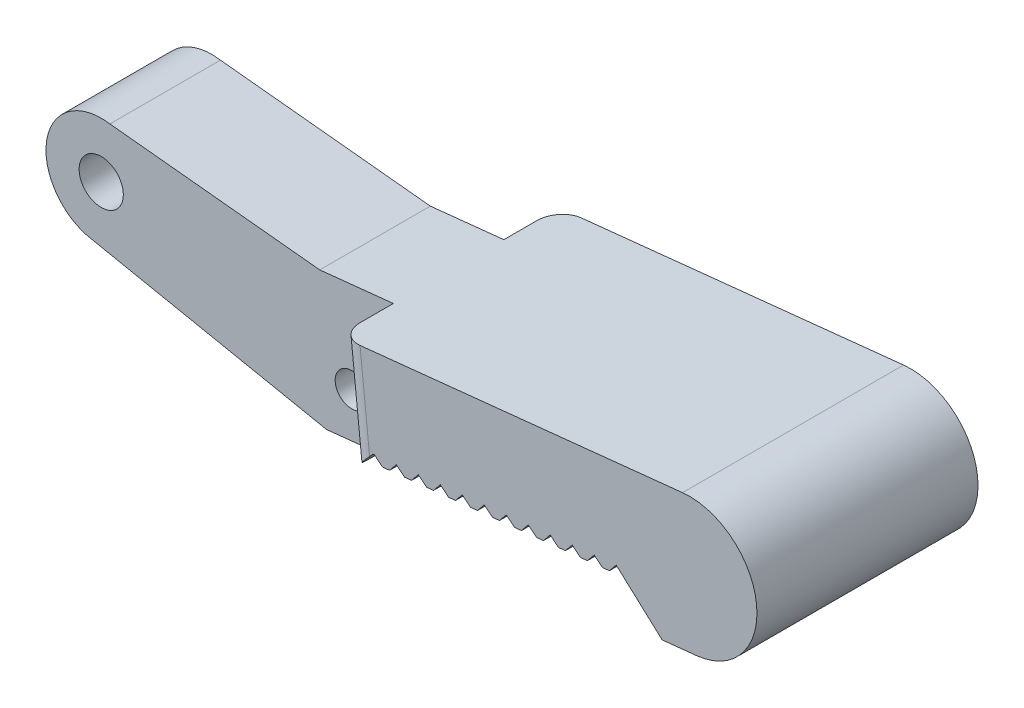
from build123d import *
from OCP.BRepFilletAPI import BRepFilletAPI_MakeChamfer

# Parameters (mm, degrees)
BOSS_EXTRUDE1_DEPTH          = 10
BOSS_EXTRUDE2_START          = 5
BOSS_EXTRUDE2_DEPTH          = 5
BOSS_EXTRUDE3_DEPTH          = 5
CUT_EXTRUDE1_DEPTH           = 101.346230266
CUT_EXTRUDE2_DEPTH           = 101.346230266
CUT_EXTRUDE3_DEPTH           = 101.346230266
CUT_EXTRUDE4_DEPTH           = 101.346230266
CUT_EXTRUDE5_DEPTH           = 101.346230266
CUT_EXTRUDE6_DEPTH           = 101.346230266
CUT_EXTRUDE7_DEPTH           = 101.346230266
CUT_EXTRUDE8_DEPTH           = 101.346230266
CUT_EXTRUDE9_DEPTH           = 101.346230266
CUT_EXTRUDE10_DEPTH          = 101.346230266
F_3_0_3_DIAMETER_HOLE1_D     = 3
F_3_0_3_DIAMETER_HOLE1_DEPTH = 15
F_4_0_4_DIAMETER_HOLE1_D     = 4
F_4_0_4_DIAMETER_HOLE1_DEPTH = 15
CHAMFER1_SIZE                = 0.447730968
CHAMFER1_SIZE2               = 0.448197344
CHAMFER2_SIZE                = 0.447731694
CHAMFER3_SIZE                = 1.737611999
CHAMFER3_SIZE2               = 3.873994542
CHAMFER4_SIZE                = 0.077086633
CHAMFER4_SIZE2               = 0.072550959
FILLET1_R                    = 2


with BuildPart() as part:
    # Sketch1 → Boss-Extrude1 (new body)
    with BuildSketch(Plane.XY.offset(73)):
        with BuildLine():
            Line((47.149864614, 28.313385702), (52.6195399, 34.322554537))
            Line((52.6195399, 34.322554537), (64.759552346, 24.481253068))
            Line((64.759552346, 24.481253068), (74.555166546, 36.564906707))
            Line((74.555166546, 36.564906707), (78.7164935, 32.777177019))
            Line((78.7164935, 32.777177019), (81.827328883, 33.102494763))
            ThreePointArc((81.827328883, 33.102494763), (87.259793057, 39.803862757), (80.558425063, 45.236326931))
            Line((80.558425063, 45.236326931), (42.738053563, 41.281235646))
            Line((42.738053563, 41.281235646), (23.75043876, 43.222902971))
            ThreePointArc((23.75043876, 43.222902971), (18.027652603, 39.069624916), (22.180930658, 33.346838759))
            Line((22.180930658, 33.346838759), (47.149864614, 28.313385702))
        make_face()
    extrude(amount=-BOSS_EXTRUDE1_DEPTH)

    # Sketch2 → Boss-Extrude2 (add)
    with BuildSketch(Plane.XY.offset(73).offset(BOSS_EXTRUDE2_START)):
        with BuildLine():
            Line((64.759552346, 24.481253068), (52.6195399, 34.322554537))
            Line((52.6195399, 34.322554537), (50.443577375, 31.931969081))
            Line((50.443577375, 31.931969081), (49.393091426, 41.977190794))
            Line((49.393091426, 41.977190794), (80.558425063, 45.236326931))
            ThreePointArc((80.558425063, 45.236326931), (87.259793057, 39.803862757), (81.827328883, 33.102494763))
            Line((81.827328883, 33.102494763), (78.7164935, 32.777177019))
            Line((78.7164935, 32.777177019), (74.555166546, 36.564906707))
            Line((74.555166546, 36.564906707), (64.759552346, 24.481253068))
        make_face()
    extrude(amount=-BOSS_EXTRUDE2_DEPTH)

    # Sketch3 → Boss-Extrude3 (add)
    with BuildSketch(Plane(origin=(0, 0, 63), x_dir=(-1, 0, 0), z_dir=(0, 0, -1))):
        with BuildLine():
            Line((-64.759552346, 24.481253068), (-74.555166546, 36.564906707))
            Line((-74.555166546, 36.564906707), (-78.7164935, 32.777177019))
            Line((-78.7164935, 32.777177019), (-81.827328883, 33.102494763))
            ThreePointArc((-81.827328883, 33.102494763), (-87.259793057, 39.803862757), (-80.558425063, 45.236326931))
            Line((-80.558425063, 45.236326931), (-49.393091426, 41.977190794))
            Line((-49.393091426, 41.977190794), (-50.443577375, 31.931969081))
            Line((-50.443577375, 31.931969081), (-52.6195399, 34.322554537))
            Line((-52.6195399, 34.322554537), (-64.759552346, 24.481253068))
        make_face()
    extrude(amount=BOSS_EXTRUDE3_DEPTH)

    # Sketch4 → Cut-Extrude1 (cut, through all)
    with BuildSketch(Plane(origin=(0, 0, 58), x_dir=(-1, 0, 0), z_dir=(0, 0, -1))):
        Polygon((-64.759552346, 24.481253068), (-53.773703175, 33.386932043), (-54.663638401, 34.48473651), (-65.658749654, 25.590483036), align=None)
    extrude(amount=-CUT_EXTRUDE1_DEPTH, mode=Mode.SUBTRACT)

    # Sketch5 → Cut-Extrude2 (cut, through all)
    with BuildSketch(Plane(origin=(0, 0, 58), x_dir=(-1, 0, 0), z_dir=(0, 0, -1))):
        Polygon((-55.763149526, 33.595311163), (-56.652791215, 34.69275353), (-66.548391343, 26.687925403), (-65.658749654, 25.590483036), align=None)
    extrude(amount=-CUT_EXTRUDE2_DEPTH, mode=Mode.SUBTRACT)

    # Sketch6 → Cut-Extrude3 (cut, through all)
    with BuildSketch(Plane(origin=(0, 0, 58), x_dir=(-1, 0, 0), z_dir=(0, 0, -1))):
        Polygon((-57.752302341, 33.803328183), (-58.64194403, 34.90077055), (-67.438033032, 27.78536777), (-66.548391343, 26.687925403), align=None)
    extrude(amount=-CUT_EXTRUDE3_DEPTH, mode=Mode.SUBTRACT)

    # Sketch7 → Cut-Extrude4 (cut, through all)
    with BuildSketch(Plane(origin=(0, 0, 58), x_dir=(-1, 0, 0), z_dir=(0, 0, -1))):
        Polygon((-59.741455155, 34.011345202), (-60.631096844, 35.108787569), (-68.327674721, 28.882810137), (-67.438033032, 27.78536777), align=None)
    extrude(amount=-CUT_EXTRUDE4_DEPTH, mode=Mode.SUBTRACT)

    # Sketch8 → Cut-Extrude5 (cut, through all)
    with BuildSketch(Plane(origin=(0, 0, 58), x_dir=(-1, 0, 0), z_dir=(0, 0, -1))):
        Polygon((-61.73060797, 34.219362222), (-62.620249659, 35.316804589), (-69.217316411, 29.980252504), (-68.327674721, 28.882810137), align=None)
    extrude(amount=-CUT_EXTRUDE5_DEPTH, mode=Mode.SUBTRACT)

    # Sketch9 → Cut-Extrude6 (cut, through all)
    with BuildSketch(Plane(origin=(0, 0, 58), x_dir=(-1, 0, 0), z_dir=(0, 0, -1))):
        Polygon((-63.719760784, 34.427379242), (-64.609402474, 35.524821609), (-70.1069581, 31.077694871), (-69.217316411, 29.980252504), align=None)
    extrude(amount=-CUT_EXTRUDE6_DEPTH, mode=Mode.SUBTRACT)

    # Sketch10 → Cut-Extrude7 (cut, through all)
    with BuildSketch(Plane(origin=(0, 0, 58), x_dir=(-1, 0, 0), z_dir=(0, 0, -1))):
        Polygon((-65.708913599, 34.635396261), (-66.598555288, 35.732838628), (-70.996599789, 32.175137239), (-70.1069581, 31.077694871), align=None)
    extrude(amount=-CUT_EXTRUDE7_DEPTH, mode=Mode.SUBTRACT)

    # Sketch11 → Cut-Extrude8 (cut, through all)
    with BuildSketch(Plane(origin=(0, 0, 58), x_dir=(-1, 0, 0), z_dir=(0, 0, -1))):
        Polygon((-70.996599789, 32.175137239), (-67.697704384, 34.843706137), (-68.589121223, 35.941003426), (-71.884095525, 33.269932405), align=None)
    extrude(amount=-CUT_EXTRUDE8_DEPTH, mode=Mode.SUBTRACT)

    # Sketch12 → Cut-Extrude9 (cut, through all)
    with BuildSketch(Plane(origin=(0, 0, 58), x_dir=(-1, 0, 0), z_dir=(0, 0, -1))):
        Polygon((-69.686925691, 35.0510682), (-70.576860917, 36.148872668), (-72.775883168, 34.370021973), (-71.884095525, 33.269932405), align=None)
    extrude(amount=-CUT_EXTRUDE9_DEPTH, mode=Mode.SUBTRACT)

    # Sketch13 → Cut-Extrude10 (cut, through all)
    with BuildSketch(Plane(origin=(0, 0, 58), x_dir=(-1, 0, 0), z_dir=(0, 0, -1))):
        Polygon((-71.676372042, 35.25944732), (-72.566013732, 36.356889687), (-73.665524857, 35.46746434), (-72.775883168, 34.370021973), align=None)
    extrude(amount=-CUT_EXTRUDE10_DEPTH, mode=Mode.SUBTRACT)

    # Ø3.0 (3) Diameter Hole1
    with Locations(Plane.XY.offset(73)):
        with Locations((45.629259616, 33.33886952)):
            Hole(F_3_0_3_DIAMETER_HOLE1_D / 2, depth=F_3_0_3_DIAMETER_HOLE1_DEPTH)

    # Ø4.0 (4) Diameter Hole1
    with Locations(Plane.XY.offset(73)):
        with Locations((22.965684709, 38.284870865)):
            Hole(F_4_0_4_DIAMETER_HOLE1_D / 2, depth=F_4_0_4_DIAMETER_HOLE1_DEPTH)

    # Chamfer1: one chamfer whose edges measure the first distance from different faces: ONE call of the kernel's chamfer builder (chamfer() names one face for all edges)
    chamfer1_edges_1 = [part.edges().sort_by_distance(p)[0] for p in [
        (57.752302341, 33.803328183, 68),
    ]]
    chamfer1_side_1 = [part.faces().sort_by_distance(p)[0] for p in [
        (58.197123185, 34.352049366, 68),
    ]]
    chamfer1_edges_2 = [part.edges().sort_by_distance(p)[0] for p in [
        (59.741455155, 34.011345202, 68),
    ]]
    chamfer1_side_2 = [part.faces().sort_by_distance(p)[0] for p in [
        (60.186276, 34.560066386, 68),
    ]]
    chamfer1_edges_3 = [part.edges().sort_by_distance(p)[0] for p in [
        (61.73060797, 34.219362222, 68),
    ]]
    chamfer1_side_3 = [part.faces().sort_by_distance(p)[0] for p in [
        (62.175428814, 34.768083405, 68),
    ]]
    chamfer1_edges_4 = [part.edges().sort_by_distance(p)[0] for p in [
        (63.719760784, 34.427379242, 68),
    ]]
    chamfer1_side_4 = [part.faces().sort_by_distance(p)[0] for p in [
        (64.164581629, 34.976100425, 68),
    ]]
    chamfer1_edges_5 = [part.edges().sort_by_distance(p)[0] for p in [
        (65.708913599, 34.635396261, 68),
    ]]
    chamfer1_side_5 = [part.faces().sort_by_distance(p)[0] for p in [
        (66.153734443, 35.184117445, 68),
    ]]
    chamfer1_edges_6 = [part.edges().sort_by_distance(p)[0] for p in [
        (69.686925691, 35.0510682, 68),
        (53.773703175, 33.386932043, 68),
    ]]
    chamfer1_edges_7 = [part.edges().sort_by_distance(p)[0] for p in [
        (71.676372042, 35.25944732, 68),
    ]]
    chamfer1_side_7 = [part.faces().sort_by_distance(p)[0] for p in [
        (72.121192887, 35.808168504, 68),
    ]]
    chamfer1_edges_8 = [part.edges().sort_by_distance(p)[0] for p in [
        (73.665524857, 35.46746434, 68),
    ]]
    chamfer1_side_8 = [part.faces().sort_by_distance(p)[0] for p in [
        (74.110345702, 36.016185523, 68),
    ]]
    chamfer1_edges_9 = [part.edges().sort_by_distance(p)[0] for p in [
        (55.763149526, 33.595311163, 68),
    ]]
    chamfer1_side_9 = [part.faces().sort_by_distance(p)[0] for p in [
        (56.207970371, 34.144032346, 68),
    ]]
    chamfer1 = BRepFilletAPI_MakeChamfer(part.part.solid().wrapped)
    for e in chamfer1_edges_1:
        chamfer1.Add(CHAMFER1_SIZE, CHAMFER1_SIZE2, e.wrapped, chamfer1_side_1[0].wrapped)  # the first distance lies on this face
    for e in chamfer1_edges_2:
        chamfer1.Add(CHAMFER1_SIZE, CHAMFER1_SIZE2, e.wrapped, chamfer1_side_2[0].wrapped)  # the first distance lies on this face
    for e in chamfer1_edges_3:
        chamfer1.Add(CHAMFER1_SIZE, CHAMFER1_SIZE2, e.wrapped, chamfer1_side_3[0].wrapped)  # the first distance lies on this face
    for e in chamfer1_edges_4:
        chamfer1.Add(CHAMFER1_SIZE, CHAMFER1_SIZE2, e.wrapped, chamfer1_side_4[0].wrapped)  # the first distance lies on this face
    for e in chamfer1_edges_5:
        chamfer1.Add(CHAMFER1_SIZE, CHAMFER1_SIZE2, e.wrapped, chamfer1_side_5[0].wrapped)  # the first distance lies on this face
    for e in chamfer1_edges_6:
        chamfer1.Add(CHAMFER1_SIZE, e.wrapped)
    for e in chamfer1_edges_7:
        chamfer1.Add(CHAMFER1_SIZE, CHAMFER1_SIZE2, e.wrapped, chamfer1_side_7[0].wrapped)  # the first distance lies on this face
    for e in chamfer1_edges_8:
        chamfer1.Add(CHAMFER1_SIZE, CHAMFER1_SIZE2, e.wrapped, chamfer1_side_8[0].wrapped)  # the first distance lies on this face
    for e in chamfer1_edges_9:
        chamfer1.Add(CHAMFER1_SIZE, CHAMFER1_SIZE2, e.wrapped, chamfer1_side_9[0].wrapped)  # the first distance lies on this face
    add(Compound.cast(chamfer1.Shape()), mode=Mode.REPLACE)

    # Chamfer2
    chamfer2_edges = [part.edges().sort_by_distance(p)[0] for p in [
        (67.697704384, 34.843706137, 68),
    ]]
    chamfer(chamfer2_edges, length=CHAMFER2_SIZE)

    # Chamfer3
    chamfer3_edges = [part.edges().sort_by_distance(p)[0] for p in [
        (47.149864614, 28.313385702, 68),
    ]]
    chamfer3_side = [part.faces().sort_by_distance(p)[0] for p in [
        (50.353400599, 31.832897848, 68),
    ]]
    chamfer(chamfer3_edges, length=CHAMFER3_SIZE, length2=CHAMFER3_SIZE2, reference=chamfer3_side[0])

    # Chamfer4
    chamfer4_edges = [part.edges().sort_by_distance(p)[0] for p in [
        (52.6195399, 34.322554537, 68),
    ]]
    chamfer4_side = [part.faces().sort_by_distance(p)[0] for p in [
        (50.826370796, 32.35251878, 68),
    ]]
    chamfer(chamfer4_edges, length=CHAMFER4_SIZE, length2=CHAMFER4_SIZE2, reference=chamfer4_side[0])

    # Fillet1
    fillet1_edges = [part.edges().sort_by_distance(p)[0] for p in [
        (49.918334401, 36.954579937, 78),
        (49.918334401, 36.954579937, 58),
    ]]
    fillet(fillet1_edges, radius=FILLET1_R)


solid = part.part
